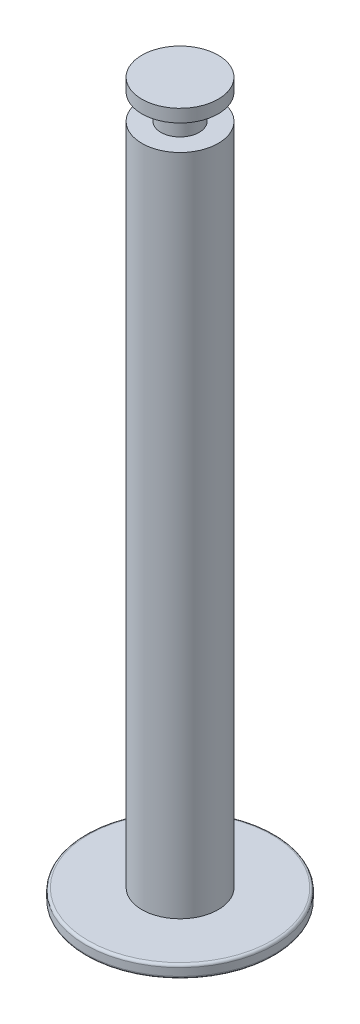
from build123d import *

# Parameters (mm, degrees)
SKETCH1_R           = 7.39
BOSS_EXTRUDE1_DEPTH = 1
FILLET1_R           = 0.2
SKETCH2_R           = 2.99
BOSS_EXTRUDE3_DEPTH = 52
SKETCH3_R           = 1.5
BOSS_EXTRUDE4_DEPTH = 2
SKETCH4_R           = 2.99
BOSS_EXTRUDE5_DEPTH = 1


with BuildPart() as part:
    # Sketch1 → Boss-Extrude1 (new body)
    with BuildSketch(Plane(origin=(0, 0, 0), x_dir=(1, 0, 0), z_dir=(0, 1, 0))):
        Circle(SKETCH1_R)
    extrude(amount=BOSS_EXTRUDE1_DEPTH)

    # Fillet1
    fillet1_edges = [part.edges().sort_by_distance(p)[0] for p in [
        (-7.39, 0, 0),
        (-7.39, 1, 0),
    ]]
    fillet(fillet1_edges, radius=FILLET1_R)

    # Sketch2 → Boss-Extrude3 (add)
    with BuildSketch(Plane(origin=(0, 1, 0), x_dir=(1, 0, 0), z_dir=(0, 1, 0))):
        Circle(SKETCH2_R)
    extrude(amount=BOSS_EXTRUDE3_DEPTH)

    # Sketch3 → Boss-Extrude4 (add)
    with BuildSketch(Plane(origin=(0, 53, 0), x_dir=(1, 0, 0), z_dir=(0, 1, 0))):
        Circle(SKETCH3_R)
    extrude(amount=BOSS_EXTRUDE4_DEPTH)

    # Sketch4 → Boss-Extrude5 (add)
    with BuildSketch(Plane(origin=(0, 55, 0), x_dir=(1, 0, 0), z_dir=(0, 1, 0))):
        Circle(SKETCH4_R)
    extrude(amount=BOSS_EXTRUDE5_DEPTH)


solid = part.part
